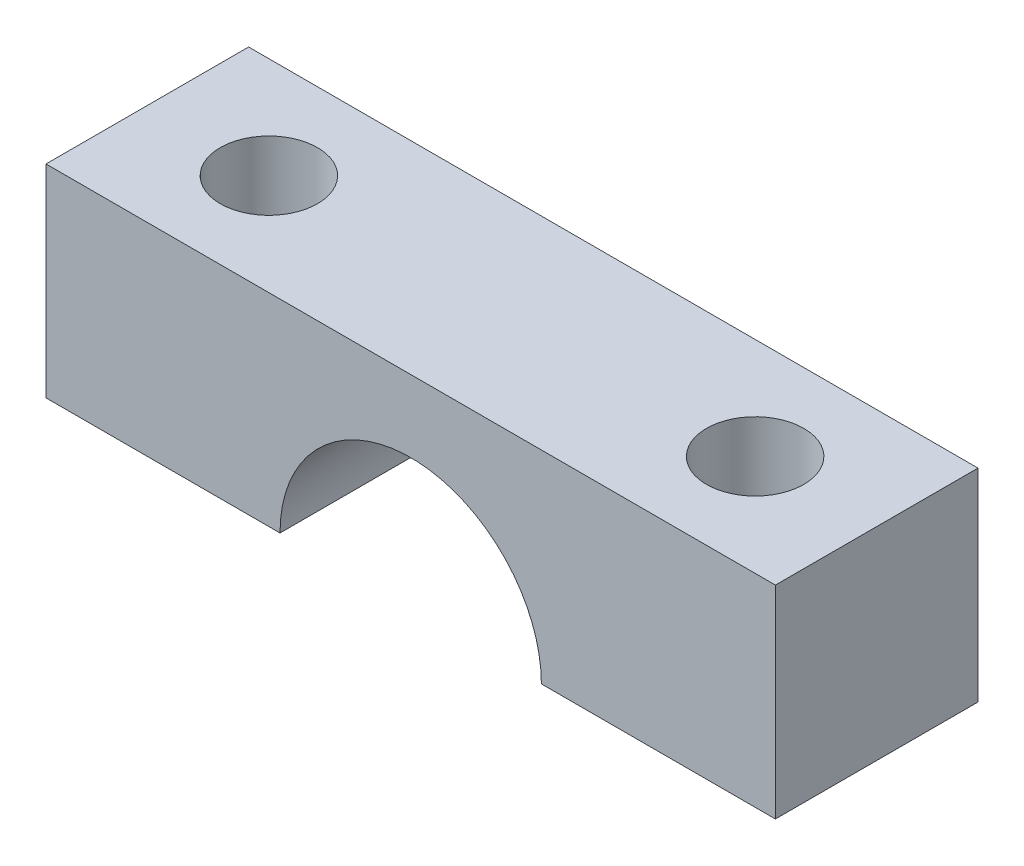
from build123d import *

# Parameters (mm, degrees)
BOSS_EXTRUDE1_DEPTH = 5
SKETCH2_R           = 1.2
CUT_EXTRUDE1_DEPTH  = 12.445523142


with BuildPart() as part:
    # Sketch1 → Boss-Extrude1 (new body)
    with BuildSketch(Plane.XY):
        with BuildLine():
            Line((3.225, 0), (9, 0))
            Line((9, 0), (9, 5))
            Line((9, 5), (-9, 5))
            Line((-9, 5), (-9, 0))
            Line((-9, 0), (-3.225, 0))
            ThreePointArc((-3.225, 0), (0, 3.225), (3.225, 0))
        make_face()
    extrude(amount=BOSS_EXTRUDE1_DEPTH)

    # Sketch2 → Cut-Extrude1 (cut, through all)
    with BuildSketch(Plane(origin=(0, 0, 0), x_dir=(1, 0, 0), z_dir=(0, 1, 0))):
        with Locations(Location((-6, -2.5, 0), (0, 0, 270))):
            Circle(SKETCH2_R)
        with Locations(Location((6, -2.5, 0), (0, 0, 90))):
            Circle(SKETCH2_R)
    extrude(amount=CUT_EXTRUDE1_DEPTH, mode=Mode.SUBTRACT)


solid = part.part
